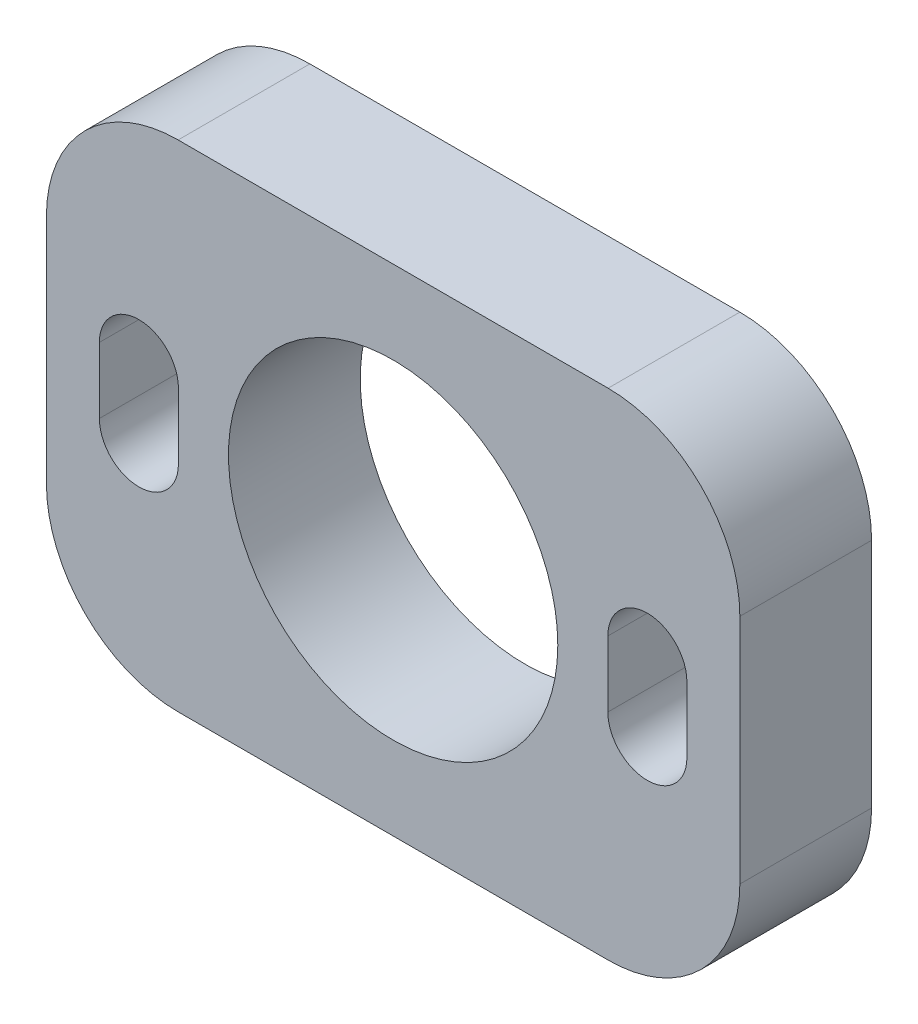
from build123d import *

# Parameters (mm, degrees)
BOSS_EXTRUDE1_DEPTH = 6.35
FILLET1_R           = 6.35


with BuildPart() as part:
    # Sketch1 → Boss-Extrude1 (new body)
    # profile 1 of 6: a face of its own
    with BuildSketch(Plane.XY.offset(-95.039403682)):
        with BuildLine():
            ThreePointArc((15.304322218, 15.940467802), (6.541322218, 24.703467802), (15.304322218, 33.466467802))
            Line((15.304322218, 33.466467802), (15.304322218, 36.641467802))
            Line((15.304322218, 36.641467802), (-1.408877782, 36.641467802))
            Line((-1.408877782, 36.641467802), (-1.408877782, 12.765467802))
            Line((-1.408877782, 12.765467802), (15.304322218, 12.765467802))
            Line((15.304322218, 12.765467802), (15.304322218, 15.940467802))
        make_face()
        with BuildLine():
            Line((1.143822218, 23.115967802), (1.143822218, 26.290967802))
            ThreePointArc((1.143822218, 26.290967802), (3.048822218, 28.195967802), (4.953822218, 26.290967802))
            Line((4.953822218, 26.290967802), (4.953822218, 23.115967802))
            ThreePointArc((4.953822218, 23.115967802), (3.048822218, 21.210967802), (1.143822218, 23.115967802))
        make_face(mode=Mode.SUBTRACT)
    # profile 2 of 6: a face of its own
    with BuildSketch(Plane.XY.offset(-95.039403682)):
        with BuildLine():
            Line((15.304322218, 36.641467802), (15.304322218, 33.466467802))
            ThreePointArc((15.304322218, 33.466467802), (21.500698942, 30.899844525), (24.067322218, 24.703467802))
            ThreePointArc((24.067322218, 24.703467802), (21.500698942, 18.507091078), (15.304322218, 15.940467802))
            Line((15.304322218, 15.940467802), (15.304322218, 12.765467802))
            Line((15.304322218, 12.765467802), (32.017522218, 12.765467802))
            Line((32.017522218, 12.765467802), (32.017522218, 36.641467802))
            Line((32.017522218, 36.641467802), (15.304322218, 36.641467802))
        make_face()
        with BuildLine():
            Line((25.654822218, 23.115967802), (25.654822218, 26.290967802))
            ThreePointArc((25.654822218, 26.290967802), (27.559822218, 28.195967802), (29.464822218, 26.290967802))
            Line((29.464822218, 26.290967802), (29.464822218, 23.115967802))
            ThreePointArc((29.464822218, 23.115967802), (27.559822218, 21.210967802), (25.654822218, 23.115967802))
        make_face(mode=Mode.SUBTRACT)
    # profile 3 of 6: a face of its own
    with BuildSketch(Plane.XY.offset(-95.039403682)):
        with BuildLine():
            ThreePointArc((15.304322218, 16.765967802), (7.366822218, 24.703467802), (15.304322218, 32.640967802))
            Line((15.304322218, 32.640967802), (15.304322218, 33.466467802))
            ThreePointArc((15.304322218, 33.466467802), (6.541322218, 24.703467802), (15.304322218, 15.940467802))
            Line((15.304322218, 15.940467802), (15.304322218, 16.765967802))
        make_face()
    # profile 4 of 6: a face of its own
    with BuildSketch(Plane.XY.offset(-95.039403682)):
        with BuildLine():
            Line((15.304322218, 33.466467802), (15.304322218, 32.640967802))
            ThreePointArc((15.304322218, 32.640967802), (20.916982294, 30.316127877), (23.241822218, 24.703467802))
            ThreePointArc((23.241822218, 24.703467802), (20.916982294, 19.090807726), (15.304322218, 16.765967802))
            Line((15.304322218, 16.765967802), (15.304322218, 15.940467802))
            ThreePointArc((15.304322218, 15.940467802), (21.500698942, 18.507091078), (24.067322218, 24.703467802))
            ThreePointArc((24.067322218, 24.703467802), (21.500698942, 30.899844525), (15.304322218, 33.466467802))
        make_face()
    # profile 5 of 6: a face of its own
    with BuildSketch(Plane.XY.offset(-95.039403682)):
        with BuildLine():
            ThreePointArc((15.304322218, 16.765967802), (7.366822218, 24.703467802), (15.304322218, 32.640967802))
            Line((15.304322218, 32.640967802), (15.304322218, 33.466467802))
            ThreePointArc((15.304322218, 33.466467802), (6.541322218, 24.703467802), (15.304322218, 15.940467802))
            Line((15.304322218, 15.940467802), (15.304322218, 16.765967802))
        make_face()
    # profile 6 of 6: a face of its own
    with BuildSketch(Plane.XY.offset(-95.039403682)):
        with BuildLine():
            Line((15.304322218, 33.466467802), (15.304322218, 32.640967802))
            ThreePointArc((15.304322218, 32.640967802), (20.916982294, 30.316127877), (23.241822218, 24.703467802))
            ThreePointArc((23.241822218, 24.703467802), (20.916982294, 19.090807726), (15.304322218, 16.765967802))
            Line((15.304322218, 16.765967802), (15.304322218, 15.940467802))
            ThreePointArc((15.304322218, 15.940467802), (21.500698942, 18.507091078), (24.067322218, 24.703467802))
            ThreePointArc((24.067322218, 24.703467802), (21.500698942, 30.899844525), (15.304322218, 33.466467802))
        make_face()
    extrude(amount=BOSS_EXTRUDE1_DEPTH)

    # Fillet1
    fillet1_edges = [part.edges().sort_by_distance(p)[0] for p in [
        (32.017522218, 12.765467802, -91.864403682),
        (-1.408877782, 12.765467802, -91.864403682),
        (-1.408877782, 36.641467802, -91.864403682),
        (32.017522218, 36.641467802, -91.864403682),
    ]]
    fillet(fillet1_edges, radius=FILLET1_R)


solid = part.part
